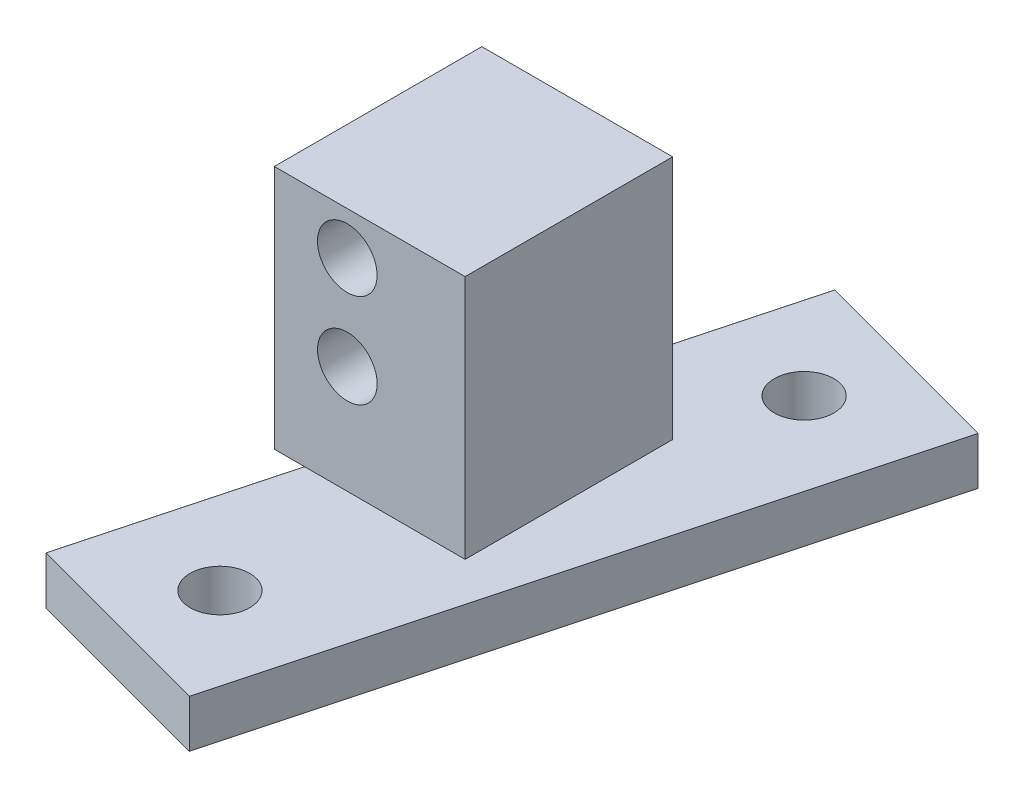
from build123d import *

# Parameters (mm, degrees)
SKETCH1_W           = 20.32
SKETCH1_H           = 26.081708108
SKETCH1_R           = 3.175
BOSS_EXTRUDE1_DEPTH = 22.098
SKETCH2_R           = 3.175
BOSS_EXTRUDE2_DEPTH = 5.08


with BuildPart() as part:
    # Sketch1 → Boss-Extrude1 (new body)
    with BuildSketch(Plane.XY):
        with Locations((-101.659894533, 115.530854428)):
            Rectangle(SKETCH1_W, SKETCH1_H)
        with Locations(Location((-104.04520642, 114, 0), (0, 0, 180))):
            Circle(SKETCH1_R, mode=Mode.SUBTRACT)
        with Locations(Location((-104.05047074, 124, 0), (0, 0, 180))):
            Circle(SKETCH1_R, mode=Mode.SUBTRACT)
    extrude(amount=BOSS_EXTRUDE1_DEPTH)

    # Sketch2 → Boss-Extrude2 (add)
    with BuildSketch(Plane(origin=(0, 102.490000374, 0), x_dir=(1, 0, 0), z_dir=(0, 1, 0))):
        Polygon((-96.663626928, 22.420429911), (-114.413437041, -43.822763256), (-93.559098452, -49.410666439), (-75.809288339, 16.832526727), align=None)
        with Locations(Location((-101.685366436, -38.029634252, 0), (0, 0, 270))):
            Circle(SKETCH2_R, mode=Mode.SUBTRACT)
        with Locations(Location((-88.537358944, 11.039397724, 0), (0, 0, 270))):
            Circle(SKETCH2_R, mode=Mode.SUBTRACT)
    extrude(amount=-BOSS_EXTRUDE2_DEPTH)


solid = part.part
